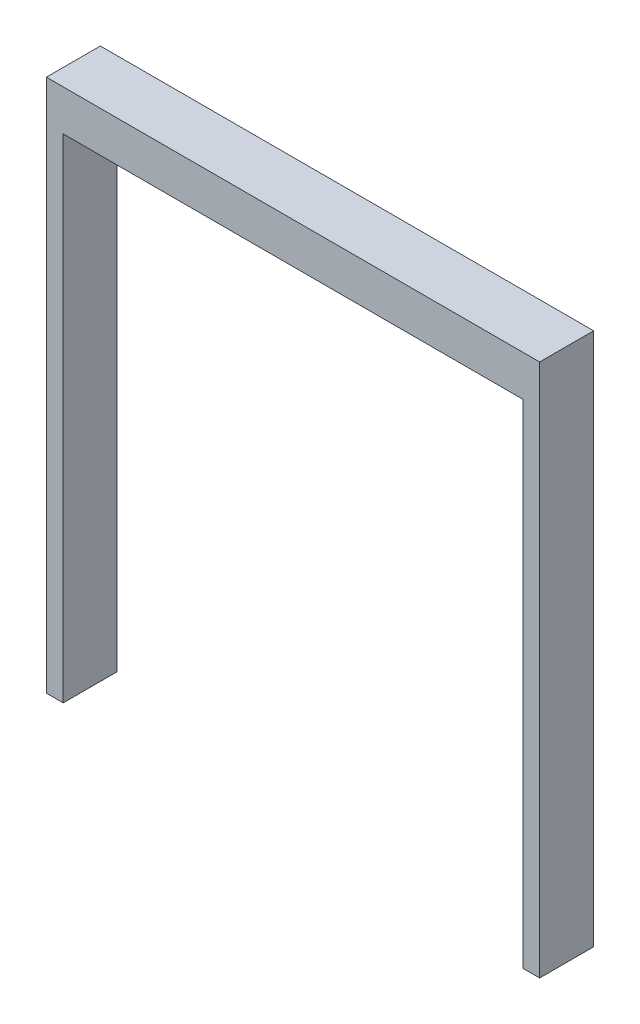
from build123d import *

# Parameters (mm, degrees)
BOSS_EXTRUDE1_DEPTH = 5.3


with BuildPart() as part:
    # Sketch1 → Boss-Extrude1 (new body)
    with BuildSketch(Plane.XY):
        Polygon((-30.857894737, 26.685087719), (17.592105263, 26.685087719), (17.592105263, -25.714912281), (15.942105263, -25.714912281), (15.942105263, 22.685087719), (-29.207894737, 22.685087719), (-29.207894737, -25.714912281), (-30.857894737, -25.714912281), align=None)
    extrude(amount=BOSS_EXTRUDE1_DEPTH)


solid = part.part
